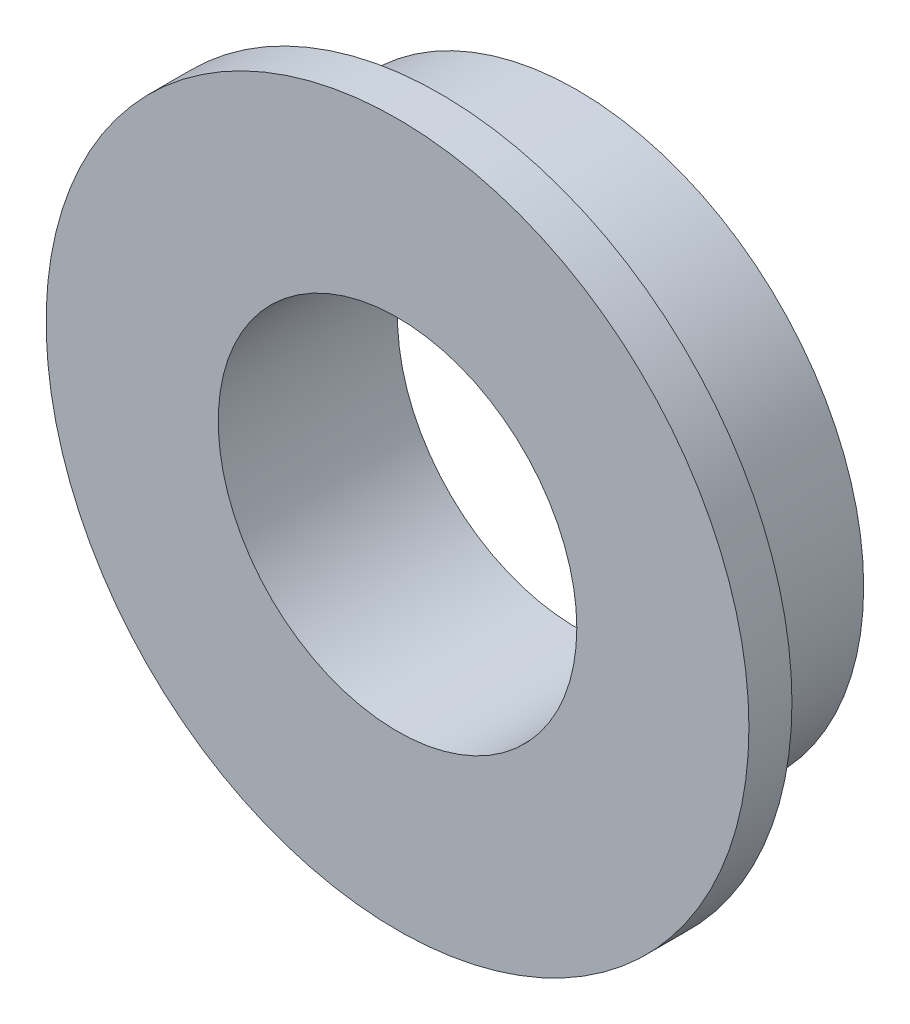
from build123d import *

# Parameters (mm, degrees)
SKETCH_2_R      = 4
SKETCH_2_R_2    = 2.5
EXTRUDE_1_DEPTH = 2.5
EXTRUDE_START   = -0.6
SKETCH_3_R      = 4.9
SKETCH_3_R_2    = 4
EXTRUDE_2_DEPTH = 0.6


with BuildPart() as part:
    # ｽｹｯﾁ2 → ﾎﾞｽ - 押し出し1 (new body)
    with BuildSketch(Plane.XY):
        Circle(SKETCH_2_R)
        Circle(SKETCH_2_R_2, mode=Mode.SUBTRACT)
    extrude(amount=EXTRUDE_1_DEPTH)

    # ｽｹｯﾁ3 → ﾎﾞｽ - 押し出し2 (add)
    with BuildSketch(Plane.XY.offset(2.5).offset(EXTRUDE_START)):
        Circle(SKETCH_3_R)
        Circle(SKETCH_3_R_2, mode=Mode.SUBTRACT)
    extrude(amount=EXTRUDE_2_DEPTH)


solid = part.part
